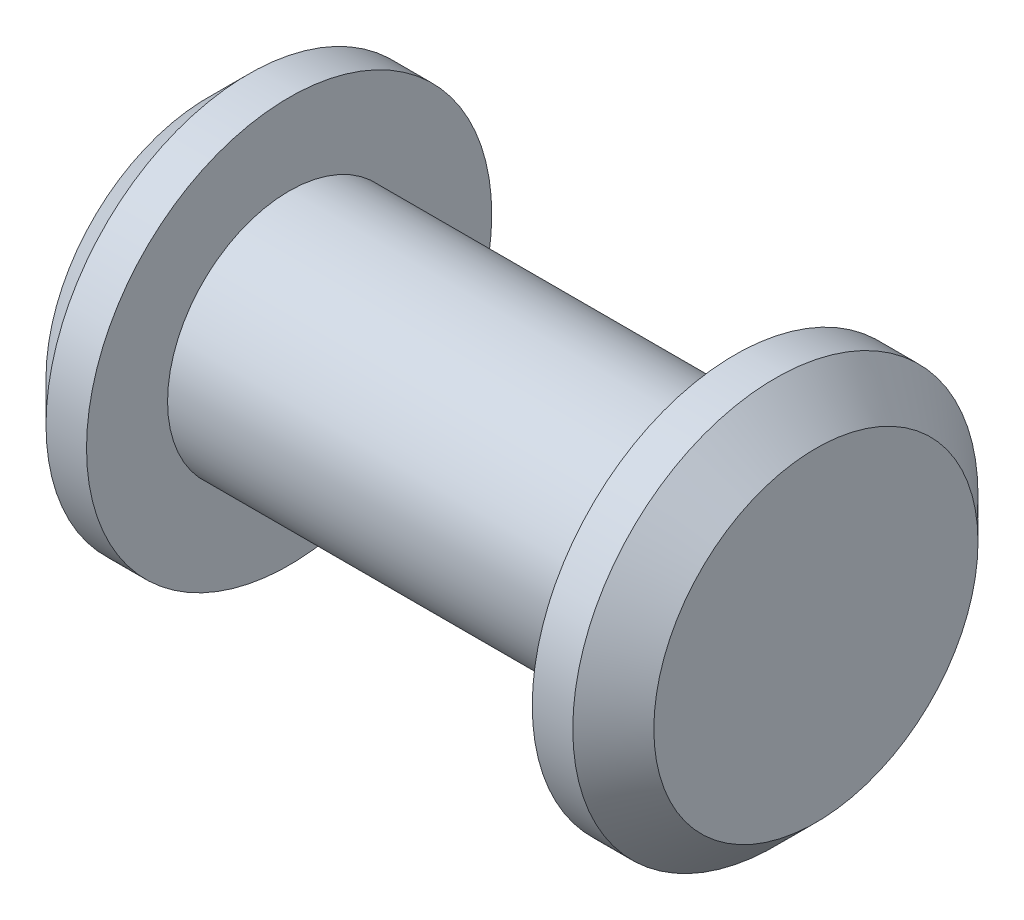
from build123d import *


with BuildPart() as part:
    # Sketch1 → Revolve1 (revolve)
    with BuildSketch(Plane.XY, mode=Mode.PRIVATE) as revolve1_sk:
        Polygon((-15, 0), (-15, 8), (-13, 10), (-11, 10), (-11, 6), (11, 6), (11, 10), (13, 10), (15, 8), (15, 0), align=None)
    revolve(revolve1_sk.sketch.rotate(Axis((-15, 0, 0), (1, 0, 0)), 90), axis=Axis((-15, 0, 0), (1, 0, 0)))


solid = part.part
